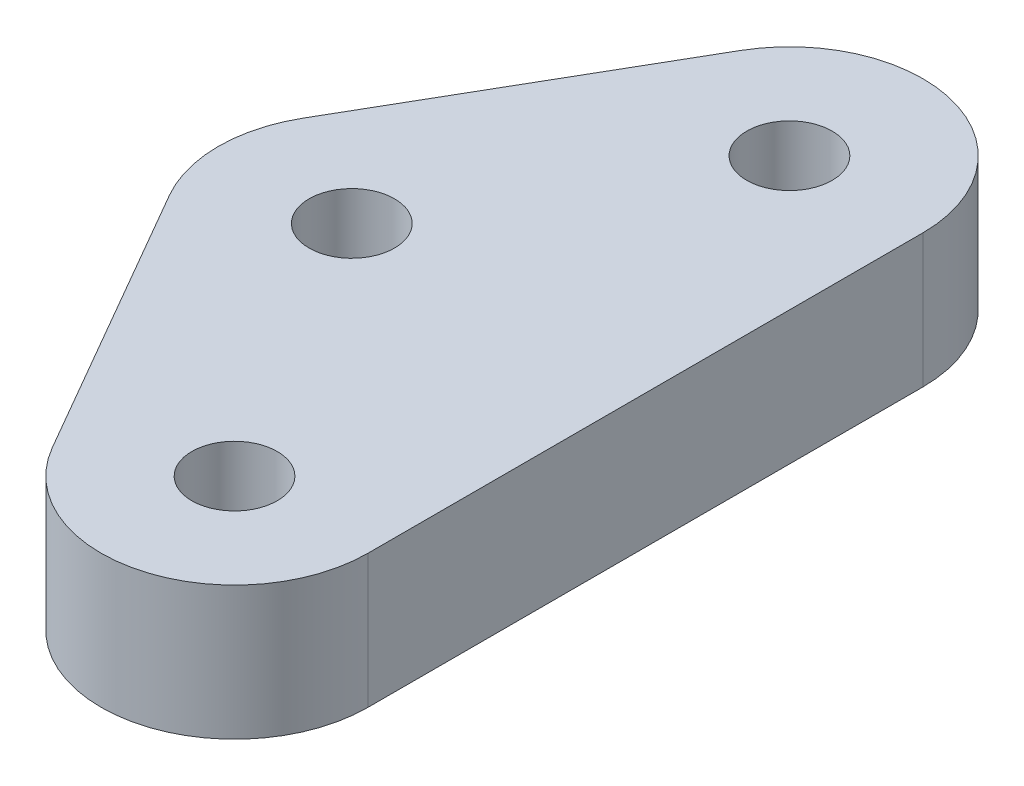
from build123d import *

# Parameters (mm, degrees)
SKETCH_1_R      = 1.6
EXTRUDE_1_DEPTH = 5


with BuildPart() as part:
    # ｽｹｯﾁ1 → ﾎﾞｽ - 押し出し1 (new body)
    with BuildSketch(Plane(origin=(0, 0, 0), x_dir=(1, 0, 0), z_dir=(0, 1, 0))):
        with BuildLine():
            Line((11, 10.392304845), (11, -10.392304845))
            ThreePointArc((11, -10.392304845), (7.294095226, -15.221933977), (1.669872981, -12.892304845))
            Line((1.669872981, -12.892304845), (-4.330127019, -2.5))
            ThreePointArc((-4.330127019, -2.5), (-5, 0), (-4.330127019, 2.5))
            Line((-4.330127019, 2.5), (1.669872981, 12.892304845))
            ThreePointArc((1.669872981, 12.892304845), (7.294095226, 15.221933977), (11, 10.392304845))
        make_face()
        with Locations(Location((0, 0, 0), (0, 0, 270))):
            Circle(SKETCH_1_R, mode=Mode.SUBTRACT)
        with Locations(Location((6, 10.392304845, 0), (0, 0, 270))):
            Circle(SKETCH_1_R, mode=Mode.SUBTRACT)
        with Locations(Location((6, -10.392304845, 0), (0, 0, 270))):
            Circle(SKETCH_1_R, mode=Mode.SUBTRACT)
    extrude(amount=EXTRUDE_1_DEPTH)


solid = part.part
